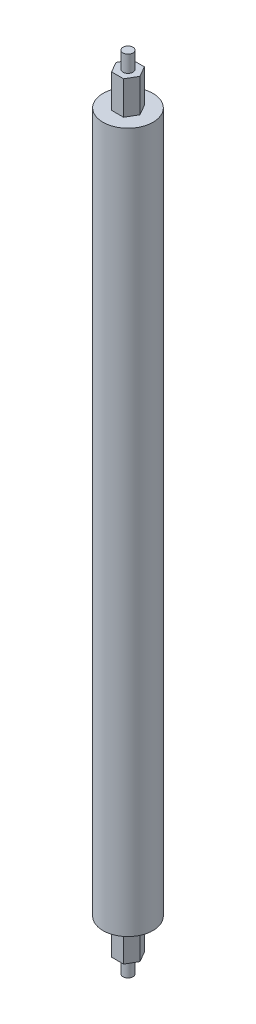
from build123d import *

# Parameters (mm, degrees)
SKETCH2_R           = 7.5
BOSS_EXTRUDE1_DEPTH = 240
CUT_EXTRUDE1_START  = -15
SKETCH3_R           = 7.5
SKETCH3_R_2         = 1.5
CUT_EXTRUDE1_DEPTH  = 15
BOSS_EXTRUDE2_DEPTH = 10


with BuildPart() as part:
    # Sketch2 → Boss-Extrude1 (new body)
    with BuildSketch(Plane(origin=(0, 0, 0), x_dir=(1, 0, 0), z_dir=(0, 1, 0))):
        with Locations(Location((0, 0, 0), (0, 0, 270))):
            Circle(SKETCH2_R)
    extrude(amount=BOSS_EXTRUDE1_DEPTH)

    # Sketch3 → Cut-Extrude1 (cut)
    with BuildSketch(Plane(origin=(0, 240, 0), x_dir=(1, 0, 0), z_dir=(0, 1, 0)).offset(CUT_EXTRUDE1_START)):
        with Locations(Location((0, 0, 0), (0, 0, 270))):
            Circle(SKETCH3_R)
        with Locations(Location((0, 0, 0), (0, 0, 270))):
            Circle(SKETCH3_R_2, mode=Mode.SUBTRACT)
    cut_extrude1 = extrude(amount=CUT_EXTRUDE1_DEPTH, mode=Mode.SUBTRACT)

    # Sketch4 → Boss-Extrude2 (add)
    with BuildSketch(Plane(origin=(0, 225, 0), x_dir=(1, 0, 0), z_dir=(0, 1, 0))):
        Polygon((-1.8, 3.117691454), (1.8, 3.117691454), (3.6, 0), (1.8, -3.117691454), (-1.8, -3.117691454), (-3.6, 0), align=None)
    boss_extrude2 = extrude(amount=BOSS_EXTRUDE2_DEPTH)

    # Mirror1: Cut-Extrude1, Boss-Extrude2 across plane
    add(cut_extrude1.mirror(Plane.ZX.offset(120)), mode=Mode.SUBTRACT)
    add(boss_extrude2.mirror(Plane.ZX.offset(120)))


solid = part.part
